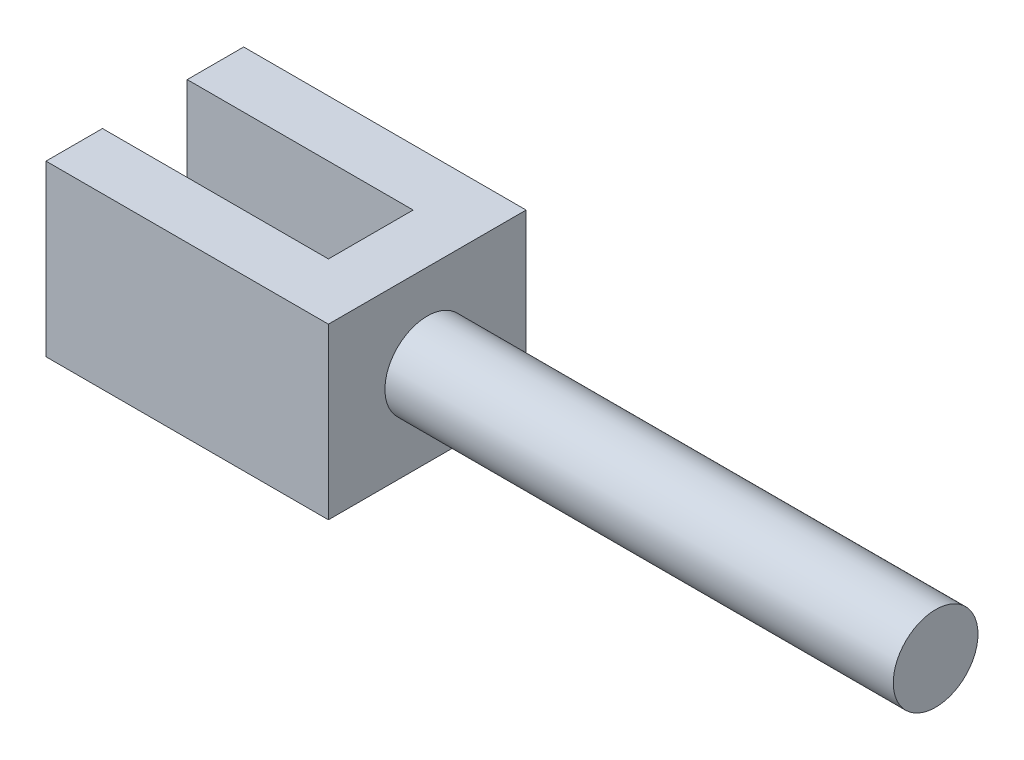
from build123d import *

# Parameters (mm, degrees)
SKETCH1_R                = 0.75
BOSS_EXTRUDE1_DEPTH      = 10
BOSS_EXTRUDE2_DEPTH      = 1.5
BOSS_EXTRUDE2_DEPTH_BACK = 1.5


with BuildPart() as part:
    # Sketch1 → Boss-Extrude1 (new body)
    with BuildSketch(Plane(origin=(0, 0, 0), x_dir=(0, 0, -1), z_dir=(1, 0, 0))):
        Circle(SKETCH1_R)
    extrude(amount=BOSS_EXTRUDE1_DEPTH)

    # Sketch2 → Boss-Extrude2 (add, two sides: drawn at the far end of the back side and taken through both)
    with BuildSketch(Plane(origin=(0, 0, 0), x_dir=(1, 0, 0), z_dir=(0, 1, 0)).offset(-BOSS_EXTRUDE2_DEPTH_BACK)):
        Polygon((1, 1.75), (1, -1.75), (-4, -1.75), (-4, -0.75), (0, -0.75), (0, 0.75), (-4, 0.75), (-4, 1.75), align=None)
    extrude(amount=BOSS_EXTRUDE2_DEPTH + BOSS_EXTRUDE2_DEPTH_BACK)


solid = part.part
